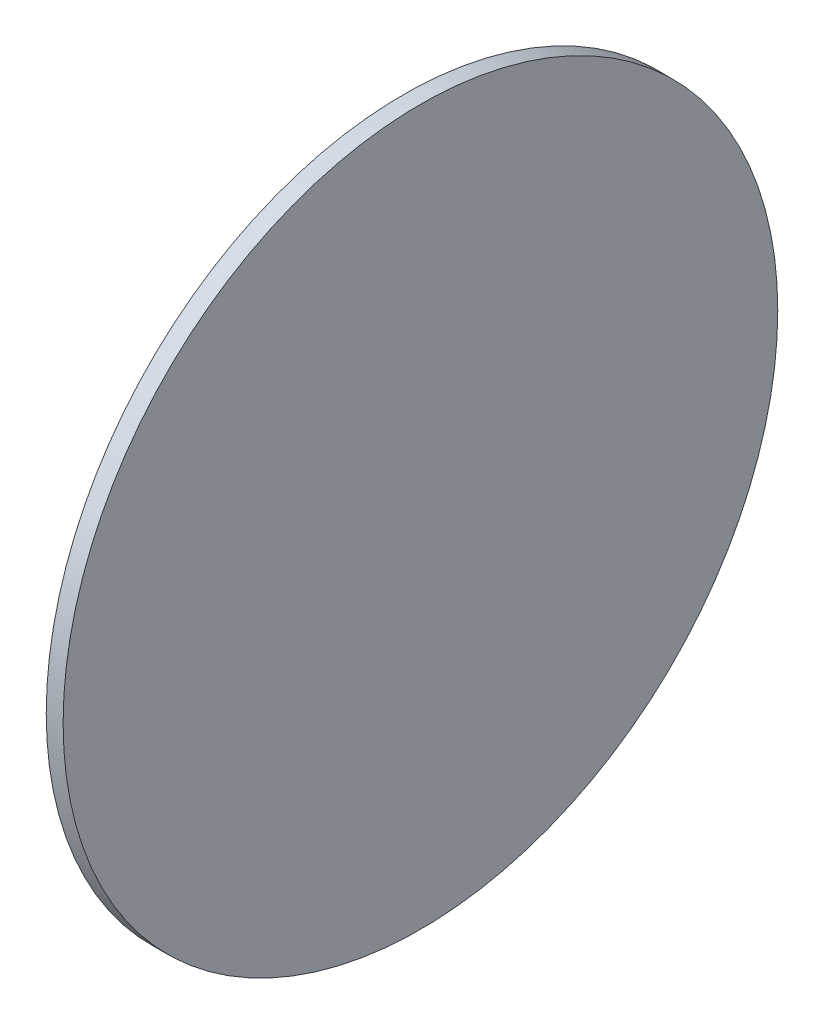
from build123d import *

# Parameters (mm, degrees)
ESQUISSE1_R        = 317.5
BOSS_EXTRU_1_DEPTH = 15


with BuildPart() as part:
    # Esquisse1 → Boss.-Extru.1 (new body)
    with BuildSketch(Plane(origin=(0, 0, 0), x_dir=(0, 0, -1), z_dir=(1, 0, 0))):
        Circle(ESQUISSE1_R)
    extrude(amount=BOSS_EXTRU_1_DEPTH)


solid = part.part
